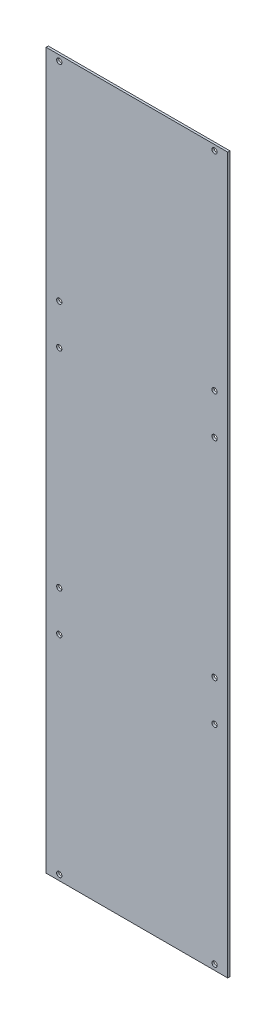
from build123d import *

# Parameters (mm, degrees)
SKETCH1_W           = 83
SKETCH1_H           = 327
BOSS_EXTRUDE1_DEPTH = 0.5
M2_HOLE1_A_D        = 2.4


with BuildPart() as part:
    # Sketch1 → Boss-Extrude1 (new, symmetric)
    with BuildSketch(Plane.XY):
        Rectangle(SKETCH1_W, SKETCH1_H)
    extrude(amount=BOSS_EXTRUDE1_DEPTH, both=True)

    # M2 Hole1 - A (through all)
    with Locations(Plane.XY.offset(0.5)):
        with Locations((-35.5, 161), (35.5, 161), (-35.5, 66), (35.5, 66), (-35.5, 47.5), (35.5, 47.5), (-35.5, -47.5), (35.5, -47.5), (-35.5, -66), (35.5, -66), (-35.5, -161), (35.5, -161)):
            Hole(M2_HOLE1_A_D / 2)


solid = part.part
